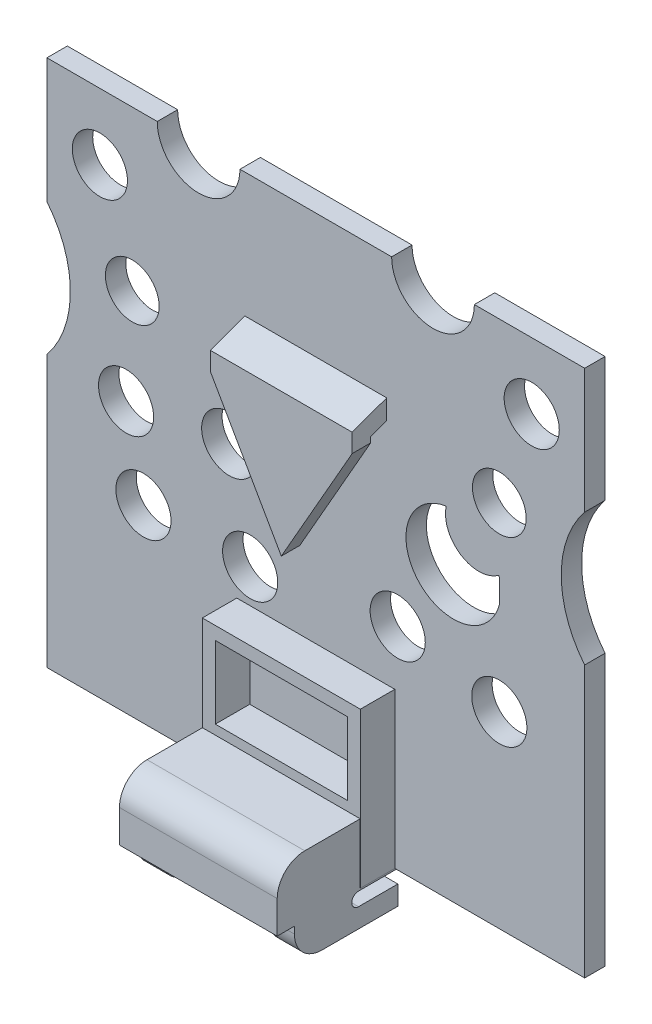
from build123d import *

# Parameters (mm, degrees)
SKETCH1_R           = 2.54
SKETCH1_R_2         = 2.4765
BOSS_EXTRUDE1_DEPTH = 1.8796
SKETCH2_R           = 2.54
CUT_EXTRUDE1_DEPTH  = 35.760967211
CUT_EXTRUDE2_DEPTH  = 35.760967211
BOSS_EXTRUDE2_DEPTH = 6.5278
CUT_EXTRUDE4_REACH  = 37.076
SKETCH6_W           = 14.5542
SKETCH6_H           = 14.2875
SKETCH6_W_2         = 12.1666
SKETCH6_H_2         = 6.6802
BOSS_EXTRUDE3_DEPTH = 3.175
BOSS_EXTRUDE4_DEPTH = 7.2644
FILLET1_R           = 2.54
SKETCH8_W           = 9.8806
SKETCH8_H           = 10.795
CUT_EXTRUDE5_DEPTH  = 7.9375
CUT_EXTRUDE6_DEPTH  = 45.081458513


with BuildPart() as part:
    # Sketch1 → Boss-Extrude1 (new body)
    with BuildSketch(Plane.XY):
        with BuildLine():
            Line((-24.765, -24.3205), (24.765, -24.3205))
            Line((24.765, -24.3205), (24.765, 24.3205))
            Line((24.765, 24.3205), (14.605, 24.3205))
            ThreePointArc((14.605, 24.3205), (10.795, 20.5105), (6.985, 24.3205))
            Line((6.985, 24.3205), (-6.985, 24.3205))
            ThreePointArc((-6.985, 24.3205), (-10.795, 20.5105), (-14.605, 24.3205))
            Line((-14.605, 24.3205), (-24.765, 24.3205))
            Line((-24.765, 24.3205), (-24.765, -24.3205))
        make_face()
        with Locations((19.8882, 18.2245)):
            Circle(SKETCH1_R, mode=Mode.SUBTRACT)
        with Locations((16.9037, 9.652)):
            Circle(SKETCH1_R_2, mode=Mode.SUBTRACT)
        with Locations(Location((-16.9037, 9.652, 0), (0, 0, 180))):
            Circle(SKETCH1_R_2, mode=Mode.SUBTRACT)
        with Locations(Location((-19.8882, 18.2245, 0), (0, 0, 180))):
            Circle(SKETCH1_R, mode=Mode.SUBTRACT)
    extrude(amount=BOSS_EXTRUDE1_DEPTH)

    # Sketch2 → Cut-Extrude1 (cut, through all)
    with BuildSketch(Plane.XY.offset(1.8796)):
        with Locations((16.9037, -7.0231)):
            Circle(SKETCH2_R)
        with BuildLine():
            Line((16.9037, 1.532940772), (16.9037, 3.724859228))
            ThreePointArc((16.9037, 3.724859228), (16.885643629, 3.792310932), (16.866511516, 3.859465433))
            ThreePointArc((16.866511516, 3.859465433), (13.369701525, 3.722012542), (12.011049817, 6.947014704))
            ThreePointArc((12.011049817, 6.947014704), (9.433252208, -0.300277005), (16.9037, 1.532940772))
        make_face()
        with Locations((-7.9756, 1.9177)):
            Circle(SKETCH2_R)
        with Locations((-17.4752, 0.5715)):
            Circle(SKETCH2_R)
        with Locations((-6.0452, -6.9215)):
            Circle(SKETCH2_R)
        with Locations((-15.875, -6.9215)):
            Circle(SKETCH2_R)
        with Locations((7.5438, -4.8895)):
            Circle(SKETCH2_R)
    extrude(amount=-CUT_EXTRUDE1_DEPTH, mode=Mode.SUBTRACT)

    # Sketch3 → Cut-Extrude2 (cut, through all)
    with BuildSketch(Plane.XY.offset(1.8796)):
        with BuildLine():
            Line((24.765, 12.8397), (24.765, 0.6477))
            ThreePointArc((24.765, 0.6477), (22.606, 6.7437), (24.765, 12.8397))
        make_face()
    cut_extrude2 = extrude(amount=-CUT_EXTRUDE2_DEPTH, mode=Mode.SUBTRACT)

    # Mirror1: Cut-Extrude2 across plane
    add(cut_extrude2.mirror(Plane(origin=(0, 0, 0), x_dir=(0, 0, 1), z_dir=(1, 0, 0))), mode=Mode.SUBTRACT)

    # Sketch4 → Boss-Extrude2 (add, symmetric)
    with BuildSketch(Plane(origin=(0, 0, 0), x_dir=(0, 0, -1), z_dir=(1, 0, 0))):
        Polygon((-1.8796, 12.8397), (-5.0546, 11.684094506), (-5.0546, -1.4605), (-3.3528, -1.4605), (-3.3528, 10.492481318), (-1.8796, 11.028682267), align=None)
    extrude(amount=BOSS_EXTRUDE2_DEPTH, both=True)

    # Sketch5 → Cut-Extrude4 (cut, up to next)
    with BuildSketch(Plane.XY.offset(5.0546), mode=Mode.PRIVATE) as cut_extrude4_sk1:
        Polygon((-6.5278, -1.4605), (0, -1.4605), (-6.5278, 9.982294506), align=None)
    cut_extrude4_tool1 = extrude(cut_extrude4_sk1.sketch, amount=-CUT_EXTRUDE4_REACH, mode=Mode.PRIVATE) & part.part
    # Sketch5 → Cut-Extrude4 (cut, up to next)
    with BuildSketch(Plane.XY.offset(5.0546), mode=Mode.PRIVATE) as cut_extrude4_sk2:
        Polygon((6.5278, 9.982294506), (0, -1.4605), (6.5278, -1.4605), align=None)
    cut_extrude4_tool2 = extrude(cut_extrude4_sk2.sketch, amount=-CUT_EXTRUDE4_REACH, mode=Mode.PRIVATE) & part.part
    add(cut_extrude4_tool1.solids().sort_by_distance((-4.351867, 2.353765, 5.0546))[0], mode=Mode.SUBTRACT)
    add(cut_extrude4_tool2.solids().sort_by_distance((4.351867, 2.353765, 5.0546))[0], mode=Mode.SUBTRACT)

    # Sketch6 → Boss-Extrude3 (add)
    with BuildSketch(Plane.XY.offset(1.8796)):
        with Locations((0, -17.17675)):
            Rectangle(SKETCH6_W, SKETCH6_H)
        with Locations((0, -14.5669)):
            Rectangle(SKETCH6_W_2, SKETCH6_H_2, mode=Mode.SUBTRACT)
    extrude(amount=BOSS_EXTRUDE3_DEPTH)

    # Sketch7 → Boss-Extrude4 (add, symmetric)
    with BuildSketch(Plane(origin=(0, 0, 0), x_dir=(0, 0, -1), z_dir=(1, 0, 0))):
        Polygon((-5.0546, -18.7833), (-12.7, -18.7833), (-12.7, -24.3205), (-11.1125, -24.3205), (-11.1125, -27.4955), (-1.5875, -27.4955), (-1.5875, -24.3205), (-5.0546, -24.3205), align=None)
    extrude(amount=BOSS_EXTRUDE4_DEPTH, both=True)

    # Fillet1
    fillet1_edges = [part.edges().sort_by_distance(p)[0] for p in [
        (0, -18.7833, 12.7),
        (0, -27.4955, 11.1125),
    ]]
    fillet(fillet1_edges, radius=FILLET1_R)

    # Sketch8 → Cut-Extrude5 (cut)
    with BuildSketch(Plane.XZ.offset(27.4955)):
        with Locations((0, 5.3975)):
            Rectangle(SKETCH8_W, SKETCH8_H)
    extrude(amount=-CUT_EXTRUDE5_DEPTH, mode=Mode.SUBTRACT)

    # Sketch9 → Cut-Extrude6 (cut, through all)
    with BuildSketch(Plane.ZY.offset(7.2644)):
        with BuildLine():
            Line((5.207, -24.4729), (1.5875, -24.4729))
            Line((1.5875, -24.4729), (1.5875, -25.7175))
            Line((1.5875, -25.7175), (5.207, -25.7175))
            ThreePointArc((5.207, -25.7175), (5.8293, -25.0952), (5.207, -24.4729))
        make_face()
    extrude(amount=-CUT_EXTRUDE6_DEPTH, mode=Mode.SUBTRACT)


solid = part.part
